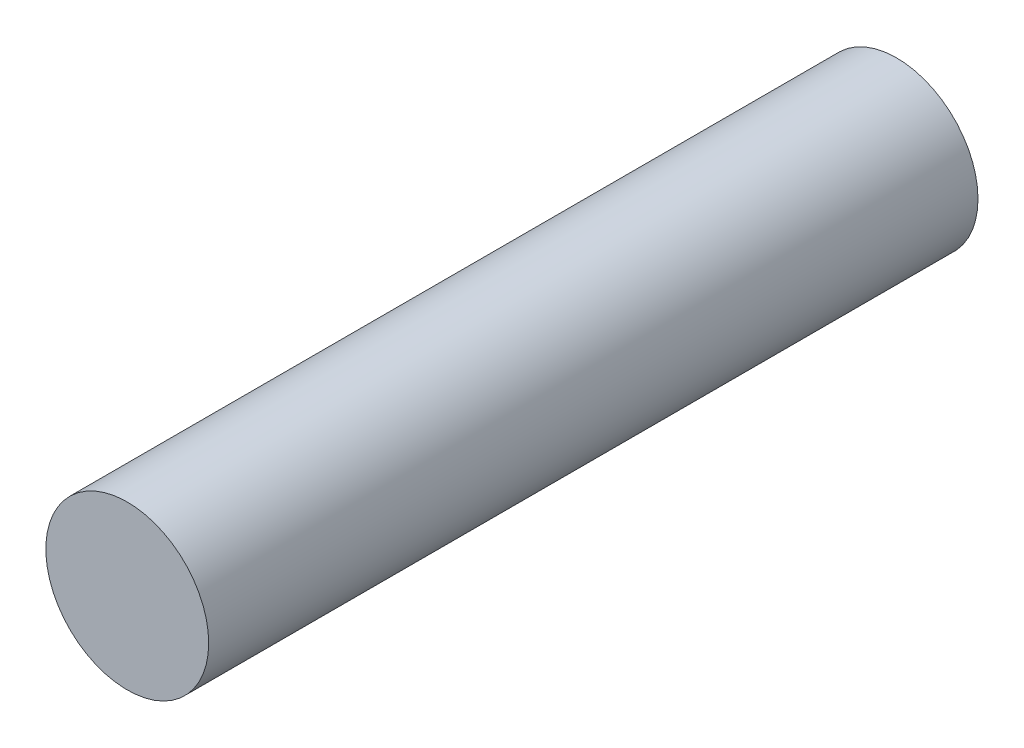
from build123d import *

# Parameters (mm, degrees)
SKETCH1_R           = 3.175
BOSS_EXTRUDE1_DEPTH = 30


with BuildPart() as part:
    # Sketch1 → Boss-Extrude1 (new body)
    with BuildSketch(Plane.XY):
        Circle(SKETCH1_R)
    extrude(amount=BOSS_EXTRUDE1_DEPTH)


solid = part.part
